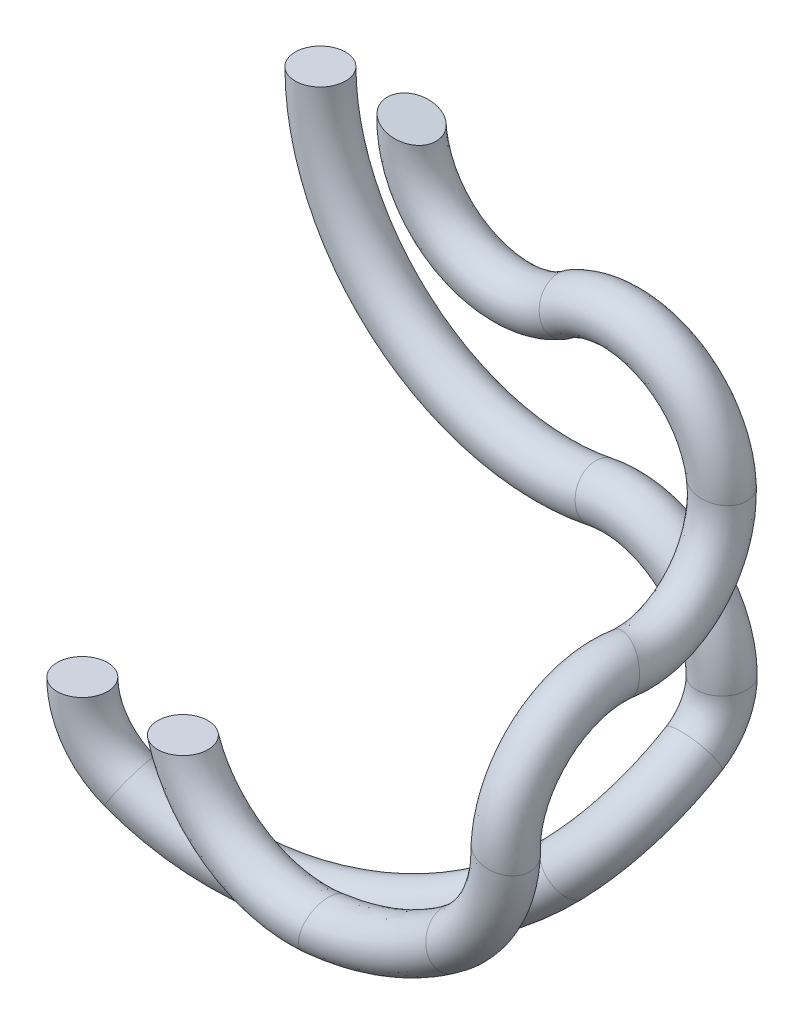
from build123d import *

# Parameters (mm, degrees)
SKETCH2_R  = 3
SKETCH12_R = 3


with BuildPart() as part:
    # Sweep1: sweep along a curve in space
    with BuildLine() as sweep1_path:
        ThreePointArc((0, 50, -27.3), (6.244182334, 39.526737318, -27.3), (18.426794799, 40.039570379, -27.3))
        ThreePointArc((36.954579843, 31.043082345, -27.3), (30.241564413, 40.794721048, -27.3), (18.426794799, 40.039570379, -27.3))
        ThreePointArc((38.412169163, 19.567530716, -13.969263691), (37.858502167, 22.26343923, -23.272323317), (36.954579843, 31.043082345, -27.3))
        ThreePointArc((38.412169163, 19.567530716, -13.969263691), (38.567543435, 16.723693034, -4.223182049), (38.533830124, 7.489990738, 0))
        ThreePointArc((32.148930084, -4.961874275, 0), (36.803020961, 0.514577671, 0), (38.533830124, 7.489990738, 0))
        ThreePointArc((16.848031948, -11, 0), (24.893095444, -8.98090889, 0), (32.148930084, -4.961874275, 0))
        ThreePointArc((0, 0, 0), (6.434008074, -8.547974244, 0), (16.848031948, -11, 0))
    # Sketch2 → Sweep1 (sweep)
    with BuildSketch(Plane(origin=(0, 0, 0), x_dir=(1, 0, 0), z_dir=(0, 1, 0))):
        Circle(SKETCH2_R)
    sweep(path=sweep1_path.line)


with BuildPart() as body_2:
    # Sweep2: sweep along a curve in space
    with BuildLine() as sweep2_path:
        ThreePointArc((-10.89, 50, -27.3), (-0.635430554, 28.424237968, -27.3), (22.569919622, 22.751370531, -27.3))
        ThreePointArc((22.569919622, 22.751370531, -27.3), (32.577566742, 20.304863366, -27.3), (37, 11, -27.3))
        ThreePointArc((37, 5.102386142, -23.985942439), (37, 7.617514718, -26.414734358), (37, 11, -27.3))
        ThreePointArc((31.58318077, -4.949268379, -14), (35.579674586, 0.398430145, -17.970267747), (37, 5.102386142, -23.985942439))
        ThreePointArc((-7.210661174, -8.841242451, -0.915312019), (13.241288535, -13.901292681, -6.41358811), (31.58318077, -4.949268379, -14))
        ThreePointArc((-12, 0, 0), (-10.723290742, -5.048344544, -0.243997631), (-7.210661174, -8.841242451, -0.915312019))
    # Sketch12 → Sweep2 (sweep)
    with BuildSketch(Plane(origin=(0, 0, 0), x_dir=(1, 0, 0), z_dir=(0, 1, 0))):
        with Locations((-12, 0)):
            Circle(SKETCH12_R)
    sweep(path=sweep2_path.line)


solid = Compound([part.part, body_2.part])
